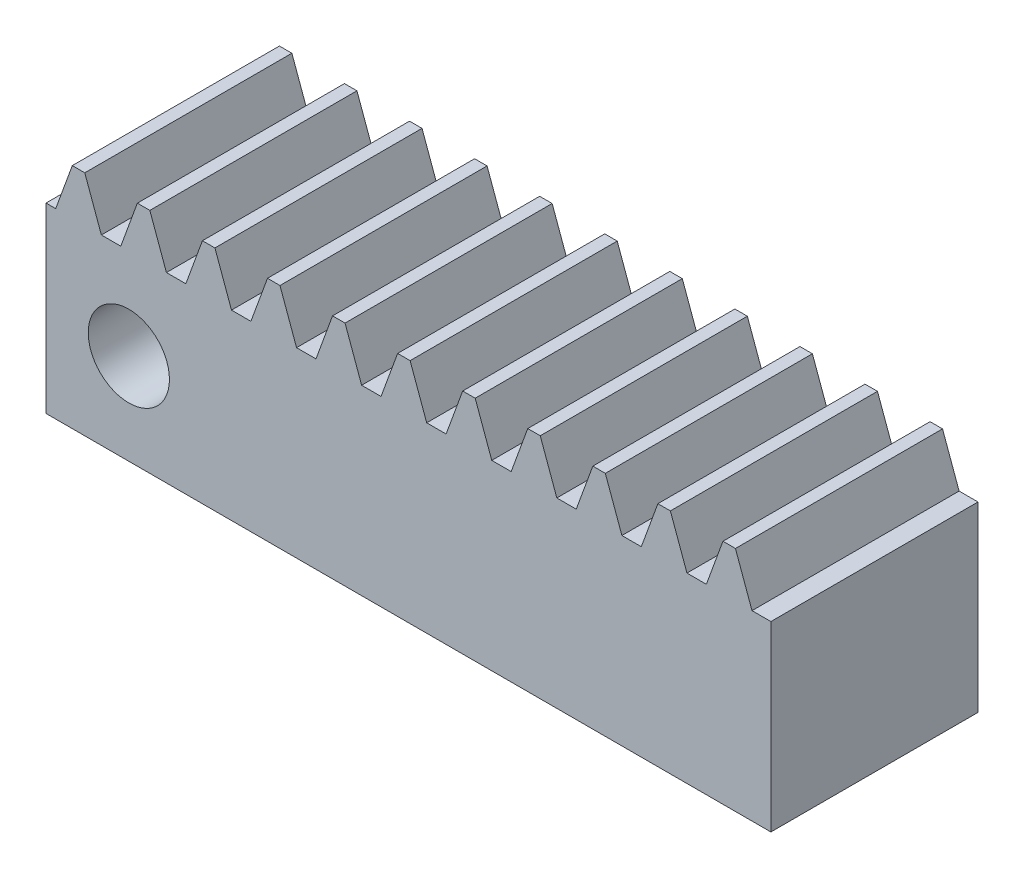
from build123d import *

# Parameters (mm, degrees)
BLANKSKE_W         = 44.45
BLANKSKE_H         = 13.97
BLANK_DEPTH        = 12.7
TOOTHCUTSIM_DEPTH  = 49.293409488
TEETHCUTS_COUNT    = 12
TEETHCUTS_PITCH    = 3.989822665
CUT_EXTRUDE1_REACH = 50.293
SKETCH1_R          = 2.4892


with BuildPart() as part:
    # BlankSke → Blank (new body)
    with BuildSketch(Plane.XY):
        with Locations((22.225, 6.985)):
            Rectangle(BLANKSKE_W, BLANKSKE_H)
    extrude(amount=-BLANK_DEPTH)

    # TooCutSkeSim → ToothCutSim (cut, through all)
    with BuildSketch(Plane.XY):
        Polygon((0.595165029, 11.176), (-0.595165029, 11.176), (-1.621342708, 13.9954), (1.621342708, 13.9954), align=None)
    toothcutsim = extrude(amount=-TOOTHCUTSIM_DEPTH, mode=Mode.SUBTRACT)

    # TeethCuts: ToothCutSim ×12
    with Locations(*[(i * TEETHCUTS_PITCH, 0, 0) for i in range(1, TEETHCUTS_COUNT)]):
        add(toothcutsim, mode=Mode.SUBTRACT)

    # Sketch1 → Cut-Extrude1 (cut, up to next)
    with BuildSketch(Plane.XY, mode=Mode.PRIVATE) as cut_extrude1_sk1:
        with Locations((5.08, 5.588)):
            Circle(SKETCH1_R)
    cut_extrude1_tool1 = extrude(cut_extrude1_sk1.sketch, amount=-CUT_EXTRUDE1_REACH, mode=Mode.PRIVATE) & part.part
    add(cut_extrude1_tool1.solids().sort_by_distance((5.08, 5.588, 0))[0], mode=Mode.SUBTRACT)


solid = part.part
